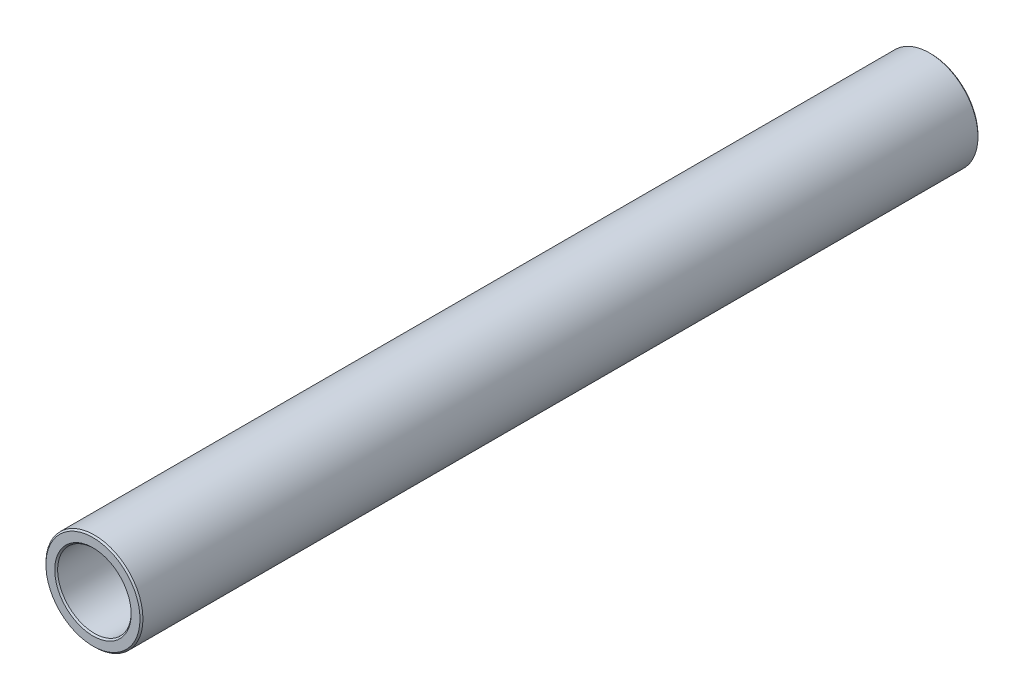
from build123d import *

# Parameters (mm, degrees)
SKETCH_1_R      = 33
SKETCH_1_R_2    = 25
EXTRUDE_1_DEPTH = 285
CHAMFER_1_SIZE  = 1


with BuildPart() as part:
    # 草图1 → 凸台-拉伸1 (new, symmetric)
    with BuildSketch(Plane.XY):
        Circle(SKETCH_1_R)
        Circle(SKETCH_1_R_2, mode=Mode.SUBTRACT)
    extrude(amount=EXTRUDE_1_DEPTH, both=True)

    # 倒角1
    chamfer_1_edges = [part.edges().sort_by_distance(p)[0] for p in [
        (-33, 0, -285),
        (-33, 0, 285),
        (-25, 0, -285),
        (-25, 0, 285),
    ]]
    chamfer(chamfer_1_edges, length=CHAMFER_1_SIZE)


solid = part.part
